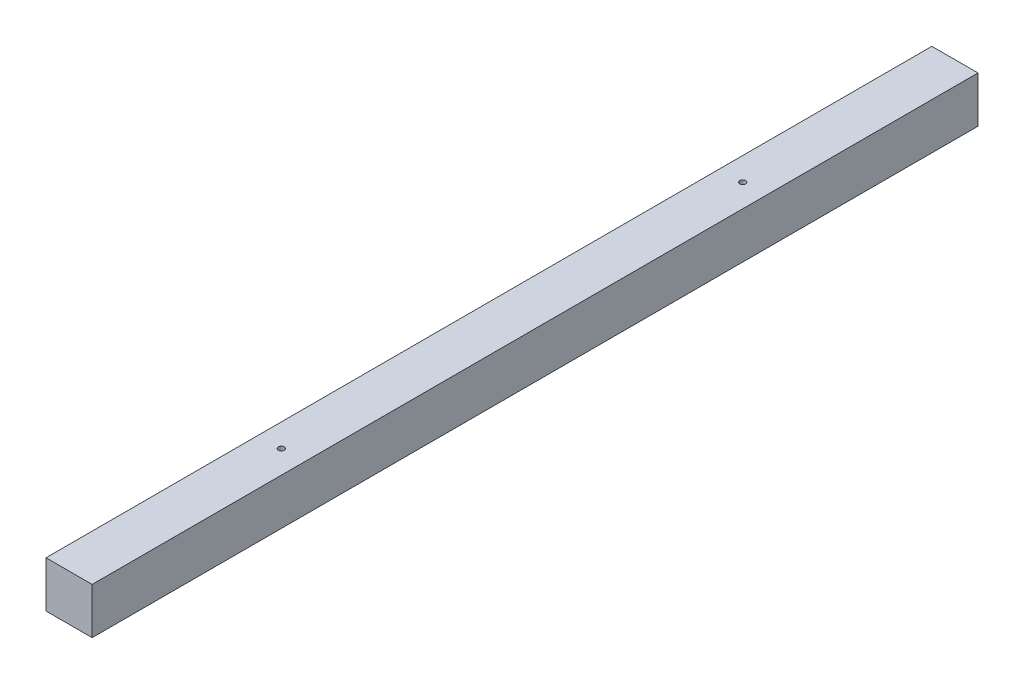
from build123d import *

# Parameters (mm, degrees)
SZKIC1_W                    = 25
SZKIC1_H                    = 25
DODANIE_WYCI_GNI_CIE1_DEPTH = 480
OTW_R_POD_RUB_M31_D         = 3.2
OTW_R_POD_RUB_M31_DEPTH     = 10
OTW_R_POD_RUB_M31_TIP       = 0.96137699


with BuildPart() as part:
    # Szkic1 → Dodanie-wyciągnięcie1 (new body)
    with BuildSketch(Plane.XY):
        with Locations((12.5, 12.5)):
            Rectangle(SZKIC1_W, SZKIC1_H)
    extrude(amount=DODANIE_WYCI_GNI_CIE1_DEPTH)

    # Otwór pod śrubę M31
    with Locations(Plane(origin=(0, 25, 0), x_dir=(1, 0, 0), z_dir=(0, 1, 0))):
        with Locations((12.5, -115), (12.5, -365)):
            Hole(OTW_R_POD_RUB_M31_D / 2, depth=OTW_R_POD_RUB_M31_DEPTH)
            with Locations((0, 0, -(OTW_R_POD_RUB_M31_DEPTH + OTW_R_POD_RUB_M31_TIP / 2))):  # 118° drill point
                Cone(0, OTW_R_POD_RUB_M31_D / 2, OTW_R_POD_RUB_M31_TIP, mode=Mode.SUBTRACT)


solid = part.part
